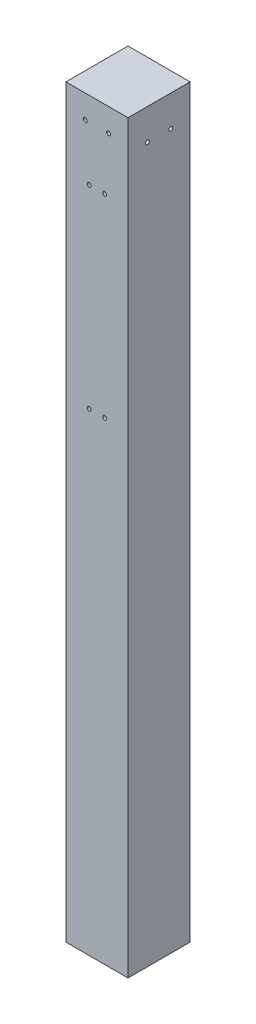
from build123d import *

# Parameters (mm, degrees)
SKETCH1_W           = 101.6
SKETCH1_H           = 101.6
BOSS_EXTRUDE1_DEPTH = 609.6
SKETCH2_R           = 3.175
CUT_EXTRUDE1_DEPTH  = 621.093025279
SKETCH3_R           = 3.175
CUT_EXTRUDE2_DEPTH  = 621.093025279
SKETCH4_R           = 3.175
CUT_EXTRUDE3_DEPTH  = 44.45


with BuildPart() as part:
    # Sketch1 → Boss-Extrude1 (new, symmetric)
    with BuildSketch(Plane(origin=(0, 0, 0), x_dir=(1, 0, 0), z_dir=(0, 1, 0))):
        Rectangle(SKETCH1_W, SKETCH1_H)
    extrude(amount=BOSS_EXTRUDE1_DEPTH, both=True)

    # Sketch2 → Cut-Extrude1 (cut, through all)
    with BuildSketch(Plane(origin=(50.8, 0, 0), x_dir=(0, 0, -1), z_dir=(1, 0, 0))):
        with Locations((-19.05, 558.8)):
            Circle(SKETCH2_R)
        with Locations((19.05, 558.8)):
            Circle(SKETCH2_R)
    extrude(amount=-CUT_EXTRUDE1_DEPTH, mode=Mode.SUBTRACT)

    # Sketch3 → Cut-Extrude2 (cut, through all)
    with BuildSketch(Plane.XY.offset(50.8)):
        with Locations((-19.05, 571.5)):
            Circle(SKETCH3_R)
        with Locations((19.05, 571.5)):
            Circle(SKETCH3_R)
    extrude(amount=-CUT_EXTRUDE2_DEPTH, mode=Mode.SUBTRACT)

    # Sketch4 → Cut-Extrude3 (cut)
    with BuildSketch(Plane.XY.offset(50.8)):
        with Locations((-12.7, 482.6)):
            Circle(SKETCH4_R)
        with Locations((12.7, 482.6)):
            Circle(SKETCH4_R)
        with Locations((-12.7, 165.1)):
            Circle(SKETCH4_R)
        with Locations((12.7, 165.1)):
            Circle(SKETCH4_R)
    extrude(amount=-CUT_EXTRUDE3_DEPTH, mode=Mode.SUBTRACT)


solid = part.part
